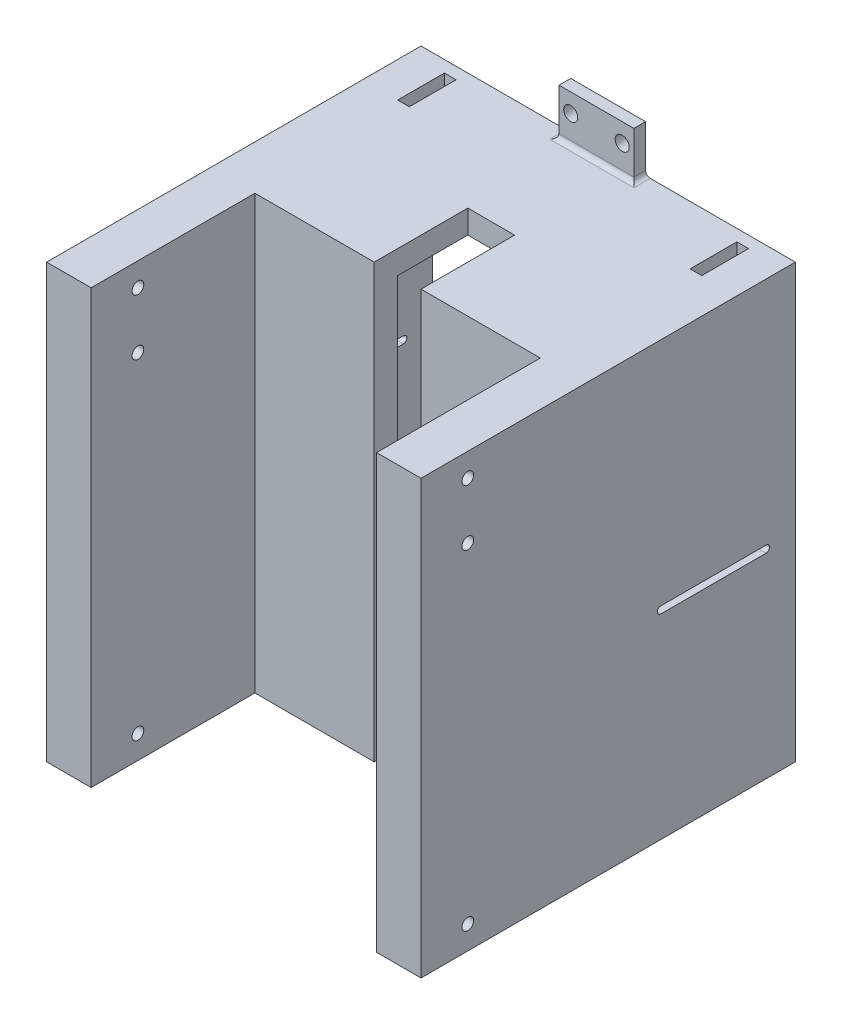
from build123d import *

# Parameters (mm, degrees)
SKETCH_1_W               = 160
SKETCH_1_H               = 185
EXTRUDE_1_DEPTH          = 10
EXTRUDE_2_DEPTH          = 80
SKETCH_14_W              = 20
SKETCH_14_H              = 50
CUT_EXTRUDE_4_DEPTH      = 258.342184649
SKETCH_16_W              = 32
SKETCH_16_H              = 20
EXTRUDE_7_DEPTH          = 5
CUT_EXTRUDE_7_REACH      = 262.624
SKETCH_18_R              = 3
FILLET_1_R               = 2
SKETCH_21_W              = 70
SKETCH_21_H              = 185
SKETCH_21_R              = 2.5
EXTRUDE_8_DEPTH          = 160
CUT_EXTRUDE_9_DEPTH      = 255.263642702
CUT_EXTRUDE_9_DEPTH_BACK = 255.263642702
SKETCH_23_W              = 122
SKETCH_23_H              = 70
CUT_EXTRUDE_10_DEPTH     = 258.342184649
CUT_EXTRUDE_11_REACH     = 259.342
SKETCH_24_W              = 5
SKETCH_24_H              = 20


with BuildPart() as part:
    # 草圖1 → 填料-伸長1 (new body)
    with BuildSketch(Plane.XY):
        with Locations((-80, -92.5)):
            Rectangle(SKETCH_1_W, SKETCH_1_H)
    extrude(amount=EXTRUDE_1_DEPTH)

    # 草圖2 → 填料-伸長2 (add)
    with BuildSketch(Plane(origin=(0, 0, 0), x_dir=(-1, 0, 0), z_dir=(0, 0, -1))):
        Polygon((0, 0), (0, -185), (5, -185), (5, -10), (155, -10), (155, -185), (160, -185), (160, 0), align=None)
    extrude(amount=EXTRUDE_2_DEPTH)

    # 草圖14 → 除料-伸長4 (cut, through all)
    with BuildSketch(Plane(origin=(0, 0, 0), x_dir=(1, 0, 0), z_dir=(0, 1, 0))):
        with Locations((-80, 5)):
            Rectangle(SKETCH_14_W, SKETCH_14_H)
    extrude(amount=-CUT_EXTRUDE_4_DEPTH, mode=Mode.SUBTRACT)

    # 草圖16 → 填料-伸長7 (add)
    with BuildSketch(Plane(origin=(0, 0, -80), x_dir=(-1, 0, 0), z_dir=(0, 0, -1))):
        with Locations((80, 10)):
            Rectangle(SKETCH_16_W, SKETCH_16_H)
    extrude(amount=-EXTRUDE_7_DEPTH)

    # 草圖18 → 除料-伸長7 (cut, up to next)
    with BuildSketch(Plane(origin=(0, 0, -80), x_dir=(-1, 0, 0), z_dir=(0, 0, -1)), mode=Mode.PRIVATE) as cut_extrude_7_sk1:
        with Locations((69, 12)):
            Circle(SKETCH_18_R)
    cut_extrude_7_tool1 = extrude(cut_extrude_7_sk1.sketch, amount=-CUT_EXTRUDE_7_REACH, mode=Mode.PRIVATE) & part.part
    # 草圖18 → 除料-伸長7 (cut, up to next)
    with BuildSketch(Plane(origin=(0, 0, -80), x_dir=(-1, 0, 0), z_dir=(0, 0, -1)), mode=Mode.PRIVATE) as cut_extrude_7_sk2:
        with Locations((91, 12)):
            Circle(SKETCH_18_R)
    cut_extrude_7_tool2 = extrude(cut_extrude_7_sk2.sketch, amount=-CUT_EXTRUDE_7_REACH, mode=Mode.PRIVATE) & part.part
    add(cut_extrude_7_tool1.solids().sort_by_distance((-69, 12, -80))[0], mode=Mode.SUBTRACT)
    add(cut_extrude_7_tool2.solids().sort_by_distance((-91, 12, -80))[0], mode=Mode.SUBTRACT)

    # 圓角1
    fillet_1_edges = [part.edges().sort_by_distance(p)[0] for p in [
        (-80, 0, -75),
        (-96, 0, -77.5),
        (-64, 0, -77.5),
    ]]
    fillet(fillet_1_edges, radius=FILLET_1_R)

    # 草圖21 → 填料-伸長8 (add)
    with BuildSketch(Plane.ZY.offset(160)):
        with Locations((45, -92.5)):
            Rectangle(SKETCH_21_W, SKETCH_21_H)
        with Locations((60, -10)):
            Circle(SKETCH_21_R, mode=Mode.SUBTRACT)
        with Locations((60, -175)):
            Circle(SKETCH_21_R, mode=Mode.SUBTRACT)
        with Locations((60, -34)):
            Circle(SKETCH_21_R, mode=Mode.SUBTRACT)
    extrude(amount=-EXTRUDE_8_DEPTH)

    # 草圖22 → 除料-伸長9 (cut, two sides: drawn at the far end of the back side and taken through both)
    with BuildSketch(Plane(origin=(-155, 0, 0), x_dir=(0, 0, -1), z_dir=(1, 0, 0)).offset(-CUT_EXTRUDE_9_DEPTH_BACK)):
        with BuildLine():
            Line((22.5, -98.5), (67.5, -98.5))
            ThreePointArc((67.5, -98.5), (69, -100), (67.5, -101.5))
            Line((67.5, -101.5), (22.5, -101.5))
            ThreePointArc((22.5, -101.5), (21, -100), (22.5, -98.5))
        make_face()
    extrude(amount=CUT_EXTRUDE_9_DEPTH + CUT_EXTRUDE_9_DEPTH_BACK, mode=Mode.SUBTRACT)

    # 草圖23 → 除料-伸長10 (cut, through all)
    with BuildSketch(Plane(origin=(0, 0, 0), x_dir=(1, 0, 0), z_dir=(0, 1, 0))):
        with Locations((-80, -45)):
            Rectangle(SKETCH_23_W, SKETCH_23_H)
    extrude(amount=-CUT_EXTRUDE_10_DEPTH, mode=Mode.SUBTRACT)

    # 草圖24 → 除料-伸長11 (cut, up to next)
    with BuildSketch(Plane(origin=(0, 0, 0), x_dir=(1, 0, 0), z_dir=(0, 1, 0)), mode=Mode.PRIVATE) as cut_extrude_11_sk1:
        with Locations((-142.5, 65)):
            Rectangle(SKETCH_24_W, SKETCH_24_H)
    cut_extrude_11_tool1 = extrude(cut_extrude_11_sk1.sketch, amount=-CUT_EXTRUDE_11_REACH, mode=Mode.PRIVATE) & part.part
    # 草圖24 → 除料-伸長11 (cut, up to next)
    with BuildSketch(Plane(origin=(0, 0, 0), x_dir=(1, 0, 0), z_dir=(0, 1, 0)), mode=Mode.PRIVATE) as cut_extrude_11_sk2:
        with Locations((-17.5, 65)):
            Rectangle(SKETCH_24_W, SKETCH_24_H)
    cut_extrude_11_tool2 = extrude(cut_extrude_11_sk2.sketch, amount=-CUT_EXTRUDE_11_REACH, mode=Mode.PRIVATE) & part.part
    add(cut_extrude_11_tool1.solids().sort_by_distance((-142.5, 0, -65))[0], mode=Mode.SUBTRACT)
    add(cut_extrude_11_tool2.solids().sort_by_distance((-17.5, 0, -65))[0], mode=Mode.SUBTRACT)


solid = part.part
